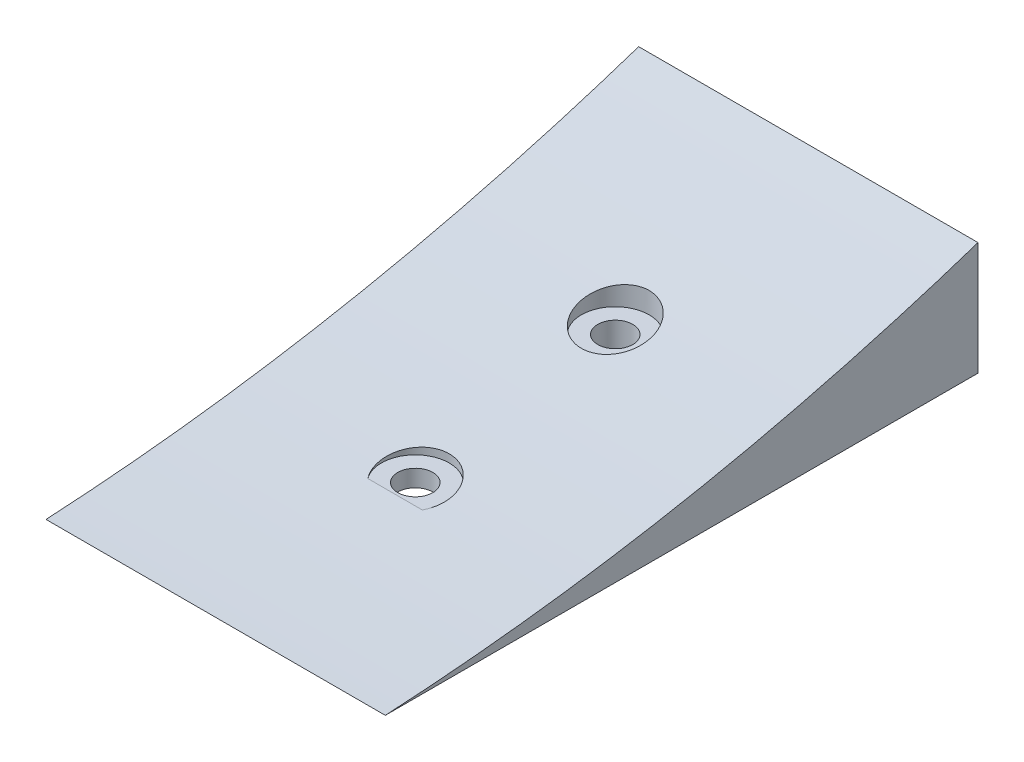
from build123d import *

# Parameters (mm, degrees)
SKETCH1_W           = 30
SKETCH1_H           = 52.4
BOSS_EXTRUDE1_DEPTH = 10
CUT_EXTRUDE1_DEPTH  = 30
SKETCH3_R           = 1.55
CUT_EXTRUDE2_DEPTH  = 14
CUT_EXTRUDE3_START  = -4
SKETCH3_4_R         = 3
SKETCH3_4_R_2       = 1.55
CUT_EXTRUDE3_DEPTH  = 12
CUT_EXTRUDE4_START  = -1.5
SKETCH3_7_R         = 3
SKETCH3_7_R_2       = 1.55
CUT_EXTRUDE4_DEPTH  = 60.702614474


with BuildPart() as part:
    # Sketch1 → Boss-Extrude1 (new body)
    with BuildSketch(Plane(origin=(0, 0, 0), x_dir=(1, 0, 0), z_dir=(0, 1, 0))):
        with Locations((15, 26.2)):
            Rectangle(SKETCH1_W, SKETCH1_H)
    extrude(amount=BOSS_EXTRUDE1_DEPTH)

    # Sketch2 → Cut-Extrude1 (cut)
    with BuildSketch(Plane(origin=(30, 0, 0), x_dir=(0, 0, -1), z_dir=(1, 0, 0))):
        with BuildLine():
            Line((52.4, 10), (0, 10))
            Line((0, 10), (0, 0))
            add(Edge.make_bspline(
                [(52.4, 10), (26.797572393, 1.464832173), (0, 0)],
                knots=[0, 0, 0, 1, 1, 1], degree=2))
        make_face()
    extrude(amount=-CUT_EXTRUDE1_DEPTH, mode=Mode.SUBTRACT)

    # Sketch3 → Cut-Extrude2 (cut)
    with BuildSketch(Plane(origin=(0, 0, 0), x_dir=(-1, 0, 0), z_dir=(0, -1, 0))):
        with Locations((-15, 35.33)):
            Circle(SKETCH3_R)
        with Locations((-15, 17.65)):
            Circle(SKETCH3_R)
    extrude(amount=-CUT_EXTRUDE2_DEPTH, mode=Mode.SUBTRACT)

    # Sketch3<4> → Cut-Extrude3 (cut)
    with BuildSketch(Plane(origin=(0, 0, 0), x_dir=(-1, 0, 0), z_dir=(0, -1, 0)).offset(CUT_EXTRUDE3_START)):
        with Locations((-15, 35.33)):
            Circle(SKETCH3_4_R)
        with Locations((-15, 35.33)):
            Circle(SKETCH3_4_R_2, mode=Mode.SUBTRACT)
    extrude(amount=-CUT_EXTRUDE3_DEPTH, mode=Mode.SUBTRACT)

    # Sketch3<7> → Cut-Extrude4 (cut, through all)
    with BuildSketch(Plane(origin=(0, 0, 0), x_dir=(-1, 0, 0), z_dir=(0, -1, 0)).offset(CUT_EXTRUDE4_START)):
        with Locations((-15, 17.65)):
            Circle(SKETCH3_7_R)
        with Locations((-15, 17.65)):
            Circle(SKETCH3_7_R_2, mode=Mode.SUBTRACT)
    extrude(amount=-CUT_EXTRUDE4_DEPTH, mode=Mode.SUBTRACT)


solid = part.part
